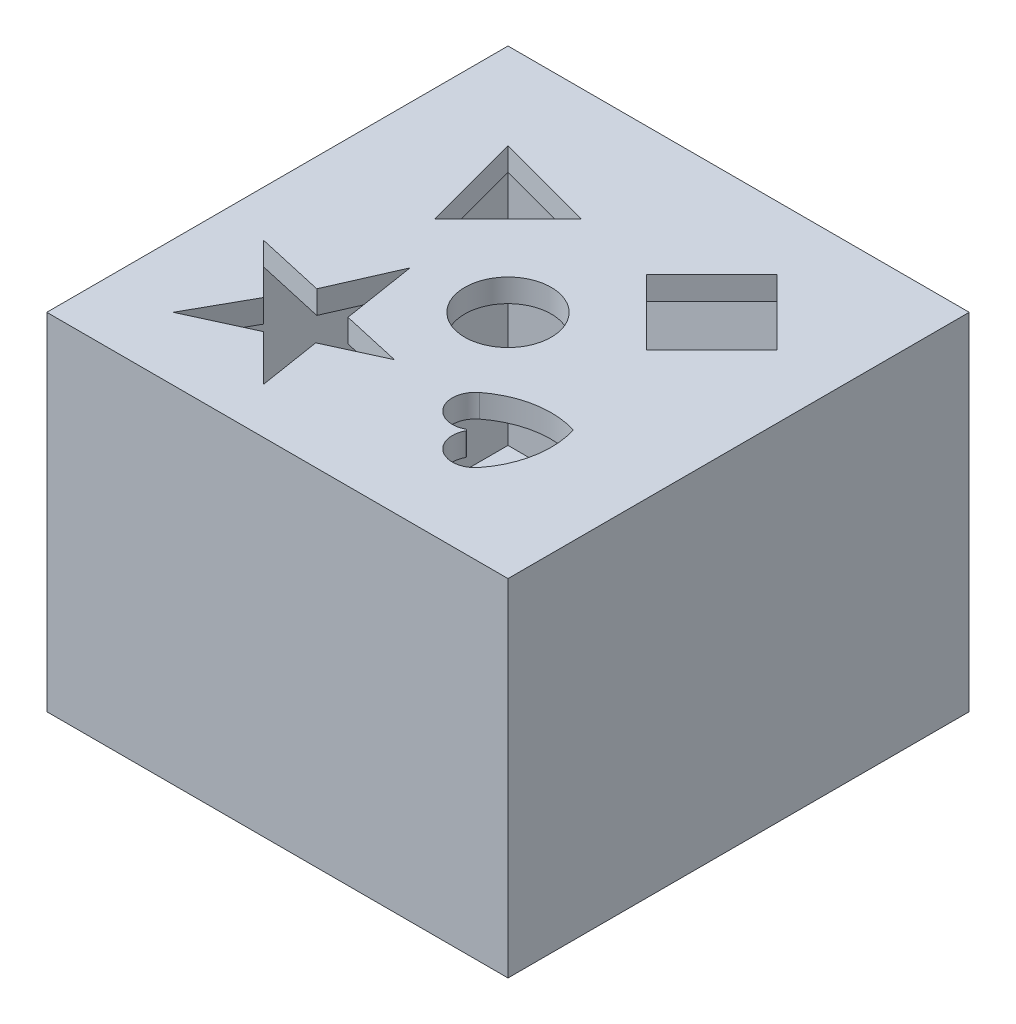
from build123d import *

# Parameters (mm, degrees)
SKETCH1_W           = 40
SKETCH1_H           = 40
BOSS_EXTRUDE1_DEPTH = 15
SKETCH2_W           = 36
SKETCH2_H           = 36
CUT_EXTRUDE1_DEPTH  = 26
SKETCH4_R           = 3.75
CUT_EXTRUDE4_DEPTH  = 2
FILLET1_R           = 0.1


with BuildPart() as part:
    # Sketch1 → Boss-Extrude1 (new, symmetric)
    with BuildSketch(Plane(origin=(0, 0, 0), x_dir=(1, 0, 0), z_dir=(0, 1, 0))):
        Rectangle(SKETCH1_W, SKETCH1_H)
    extrude(amount=BOSS_EXTRUDE1_DEPTH, both=True)

    # Sketch2 → Cut-Extrude1 (cut)
    with BuildSketch(Plane(origin=(0, 13, 0), x_dir=(1, 0, 0), z_dir=(0, 1, 0))):
        Rectangle(SKETCH2_W, SKETCH2_H)
    extrude(amount=-CUT_EXTRUDE1_DEPTH, mode=Mode.SUBTRACT)

    # Sketch4 → Cut-Extrude4 (cut)
    with BuildSketch(Plane(origin=(0, 15, 0), x_dir=(1, 0, 0), z_dir=(0, 1, 0))):
        with Locations(Location((0, 0, 0), (0, 0, 270))):
            Circle(SKETCH4_R)
        Polygon((-15.997574875, -5.191274493), (-10.056879788, -6.527978961), (-7.581971152, -0.903310223), (-6.566729947, -7.313290918), (-1.363004172, -8.484171327), (-6.041352713, -10.630392221), (-5.191274493, -15.997574875), (-9.13789809, -12.050951278), (-14.520043083, -14.520043083), (-11.706657929, -9.482191438), align=None)
        Polygon((14.495689014, 8.838834765), (8.838834765, 14.495689014), (3.181980515, 8.838834765), (8.838834765, 3.181980515), align=None)
        Polygon((-12.513069379, 12.513069379), (-10.183697973, 3.819736942), (-3.819736942, 10.183697973), align=None)
        with BuildLine():
            ThreePointArc((10.41110341, -12.903373255), (11.893574864, -9.612592954), (11.66726189, -6.01040764))
            ThreePointArc((11.66726189, -6.01040764), (8.065076576, -5.784094666), (4.774296275, -7.26656612))
            ThreePointArc((4.774296275, -7.26656612), (4.514513562, -10.166351585), (7.424621202, -10.253048327))
            ThreePointArc((7.424621202, -10.253048327), (7.511317945, -13.163155967), (10.41110341, -12.903373255))
        make_face()
    extrude(amount=-CUT_EXTRUDE4_DEPTH, mode=Mode.SUBTRACT)

    # Fillet1
    fillet1_edges = [part.edges().sort_by_distance(p)[0] for p in [
        (7.424621202, 14, 10.253048327),
    ]]
    fillet(fillet1_edges, radius=FILLET1_R)


solid = part.part
